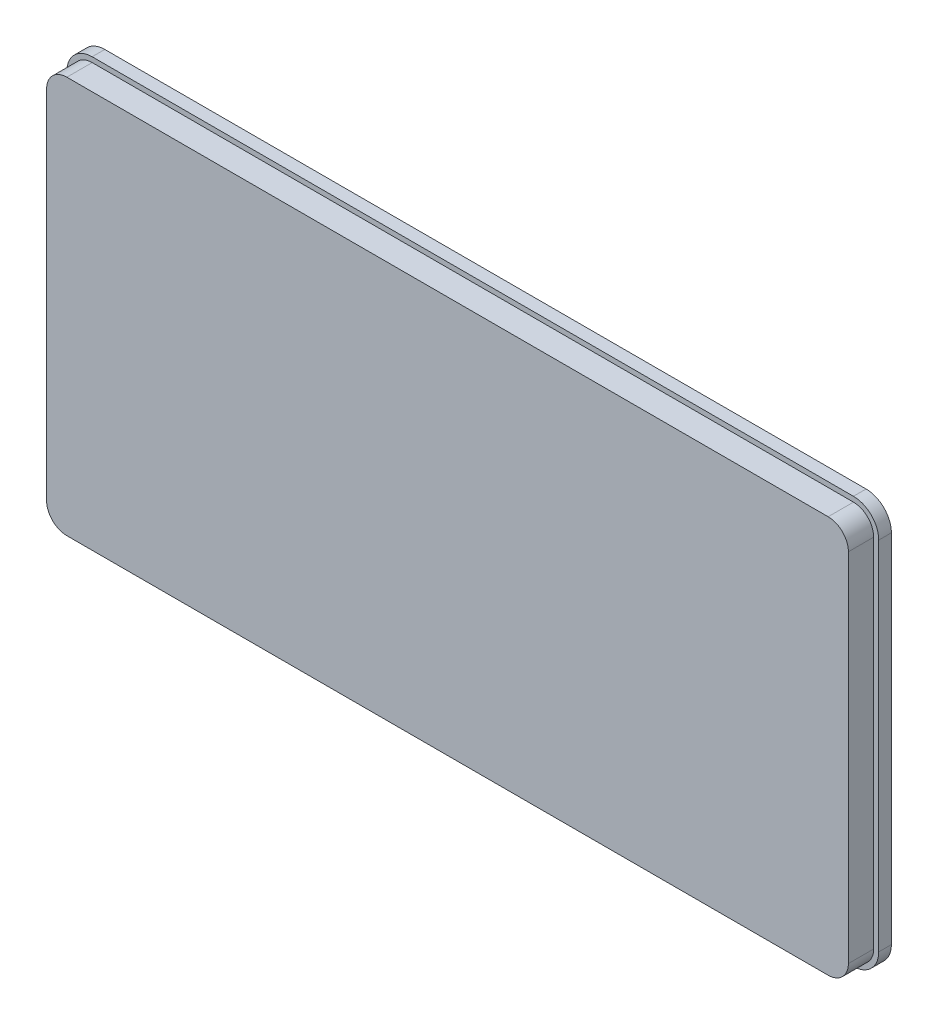
from build123d import *

# Parameters (mm, degrees)
BOSS_EXTRUDE2_DEPTH = 5
EXTRUDE_1_DEPTH     = 10


with BuildPart() as part:
    # Sketch3 → Boss-Extrude2 (new body)
    with BuildSketch(Plane.XY):
        with BuildLine():
            Line((-150.5, 80.5), (150.5, 80.5))
            ThreePointArc((150.5, 80.5), (157.571067812, 77.571067812), (160.5, 70.5))
            Line((160.5, 70.5), (160.5, -70.5))
            ThreePointArc((160.5, -70.5), (157.571067812, -77.571067812), (150.5, -80.5))
            Line((150.5, -80.5), (-150.5, -80.5))
            ThreePointArc((-150.5, -80.5), (-157.571067812, -77.571067812), (-160.5, -70.5))
            Line((-160.5, -70.5), (-160.5, 70.5))
            ThreePointArc((-160.5, 70.5), (-157.571067812, 77.571067812), (-150.5, 80.5))
        make_face()
    extrude(amount=-BOSS_EXTRUDE2_DEPTH)

    # Эскиз1 → Бобышка-Вытянуть1 (add)
    with BuildSketch(Plane(origin=(0, 0, 0), x_dir=(-1, 0, 0), z_dir=(0, 0, -1))):
        with BuildLine():
            Line((-150.5, -78.5), (150.5, -78.5))
            ThreePointArc((150.5, -78.5), (156.156854249, -76.156854249), (158.5, -70.5))
            Line((158.5, -70.5), (158.5, 70.5))
            ThreePointArc((158.5, 70.5), (156.156854249, 76.156854249), (150.5, 78.5))
            Line((150.5, 78.5), (-150.5, 78.5))
            ThreePointArc((-150.5, 78.5), (-156.156854249, 76.156854249), (-158.5, 70.5))
            Line((-158.5, 70.5), (-158.5, -70.5))
            ThreePointArc((-158.5, -70.5), (-156.156854249, -76.156854249), (-150.5, -78.5))
        make_face()
    extrude(amount=-EXTRUDE_1_DEPTH)


solid = part.part
